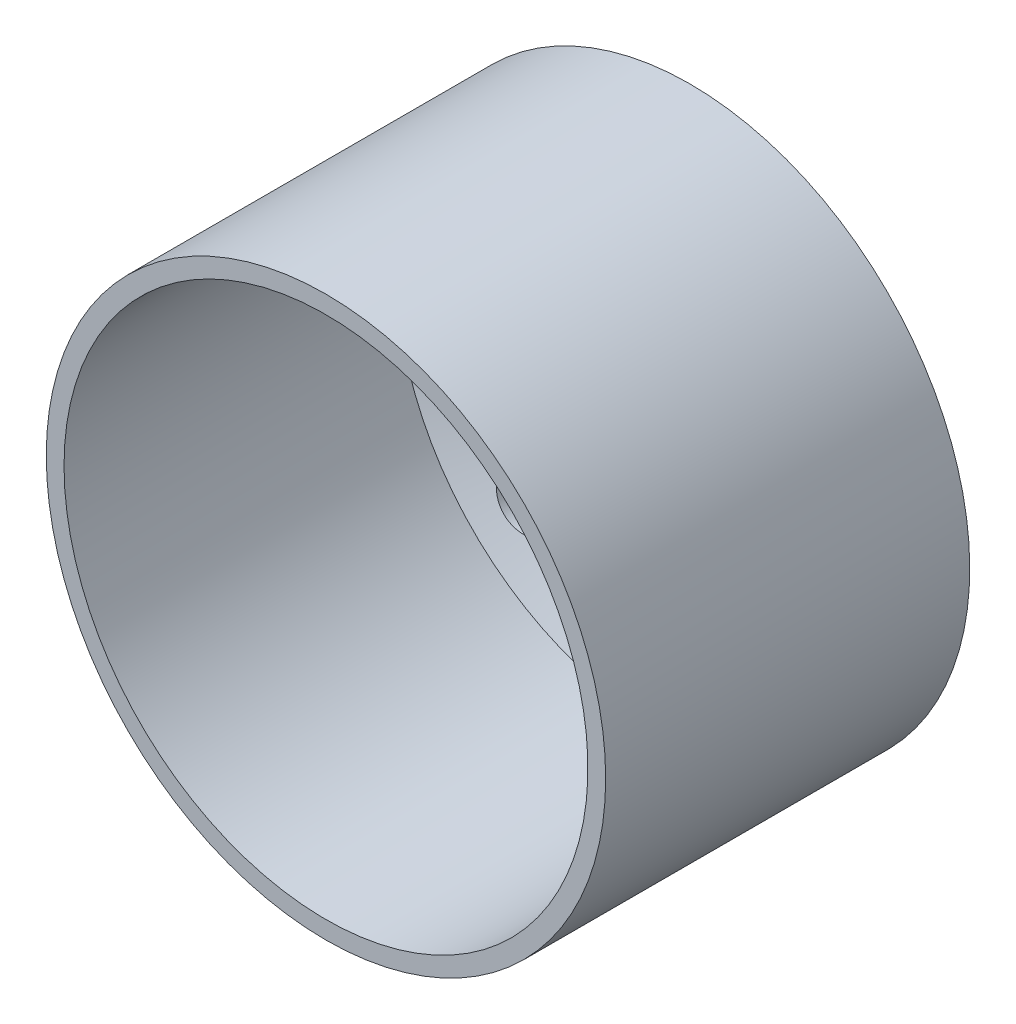
from build123d import *

# Parameters (mm, degrees)
SKETCH3_R          = 8.5
SKETCH3_R_2        = 4
SKETCH3_R_3        = 1.5
CUT_EXTRUDE1_DEPTH = 66.486639859


with BuildPart() as part:
    # Sketch1 → Revolve1 (revolve)
    with BuildSketch(Plane(origin=(0, 0, 0), x_dir=(1, 0, 0), z_dir=(0, 1, 0))):
        Polygon((31.5, -50), (31.5, -9), (15, -2), (9, -2), (9, 0), (4, 0), (4, -10), (9, -10), (9, -6), (14.186600955, -6), (29.5, -12.496593534), (29.5, -50), align=None)
    revolve(axis=Axis((0, 0, -5.732758621), (0, 0, 1)))

    # Sketch3 → Cut-Extrude1 (cut, through all)
    with BuildSketch(Plane(origin=(0, 0, 2), x_dir=(-1, 0, 0), z_dir=(0, 0, -1))):
        with Locations((-18, 0)):
            Circle(SKETCH3_R)
        with Locations((0, 18)):
            Circle(SKETCH3_R)
        with Locations((18, 0)):
            Circle(SKETCH3_R)
        with Locations((0, -18)):
            Circle(SKETCH3_R)
        with Locations((-15.909902577, 15.909902577)):
            Circle(SKETCH3_R_2)
        with Locations((15.909902577, 15.909902577)):
            Circle(SKETCH3_R_2)
        with Locations((15.909902577, -15.909902577)):
            Circle(SKETCH3_R_2)
        with Locations((-15.909902577, -15.909902577)):
            Circle(SKETCH3_R_2)
        with Locations((-8.131727984, 8.131727984)):
            Circle(SKETCH3_R_3)
        with Locations((8.131727984, 8.131727984)):
            Circle(SKETCH3_R_3)
        with Locations((8.131727984, -8.131727984)):
            Circle(SKETCH3_R_3)
        with Locations((-8.131727984, -8.131727984)):
            Circle(SKETCH3_R_3)
    extrude(amount=-CUT_EXTRUDE1_DEPTH, mode=Mode.SUBTRACT)


solid = part.part
